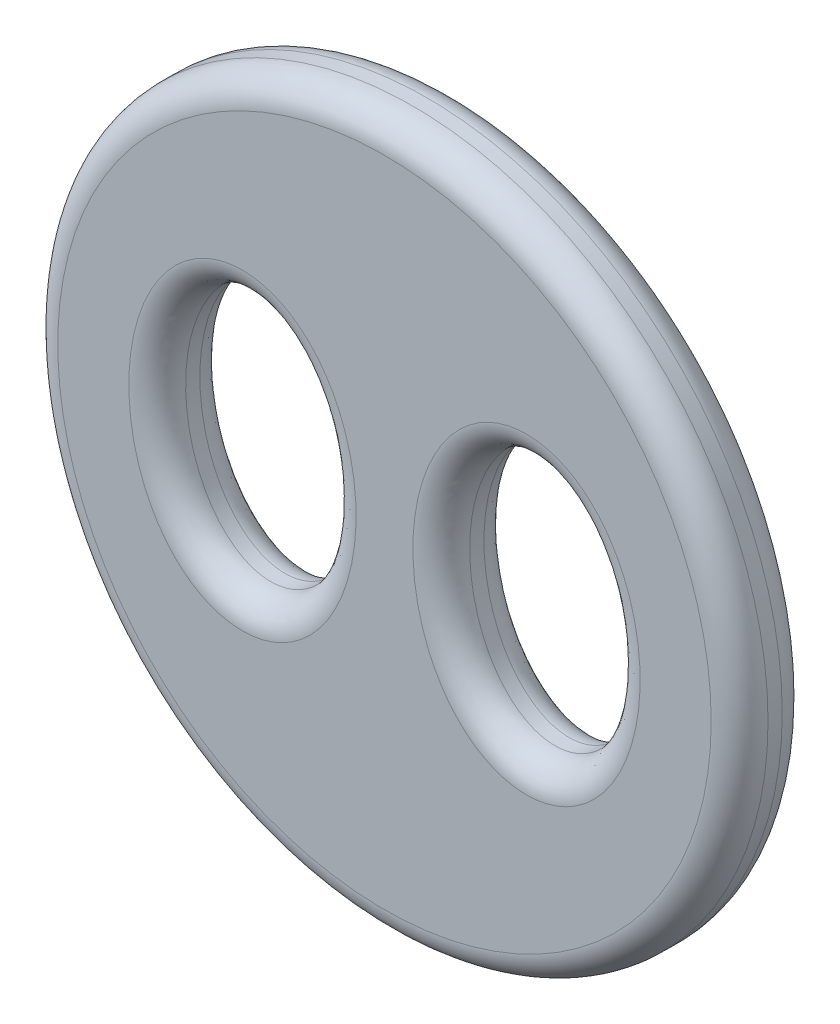
from build123d import *

# Parameters (mm, degrees)
SKETCH1_R           = 25
SKETCH1_RX          = 9
SKETCH1_RY          = 6
BOSS_EXTRUDE1_DEPTH = 5
FILLET1_R           = 2
FILLET2_R           = 2


with BuildPart() as part:
    # Sketch1 → Boss-Extrude1 (new body)
    with BuildSketch(Plane.XY):
        Circle(SKETCH1_R)
        with Locations(Location((10, 0), (0, 0, -90))):
            Ellipse(SKETCH1_RX, SKETCH1_RY, mode=Mode.SUBTRACT)
        with Locations(Location((-10, 0), (0, 0, 90))):
            Ellipse(SKETCH1_RX, SKETCH1_RY, mode=Mode.SUBTRACT)
    extrude(amount=BOSS_EXTRUDE1_DEPTH)

    # Fillet1
    fillet1_edges = [part.edges().sort_by_distance(p)[0] for p in [
        (-25, 0, 0),
        (-25, 0, 5),
    ]]
    fillet(fillet1_edges, radius=FILLET1_R)

    # Fillet2
    fillet2_edges = [part.edges().sort_by_distance(p)[0] for p in [
        (9.99361132, 8.999994898, 0),
        (9.99361132, 8.999994898, 5),
        (-9.99361132, -8.999994898, 0),
        (-9.99361132, -8.999994898, 5),
    ]]
    fillet(fillet2_edges, radius=FILLET2_R)


solid = part.part
